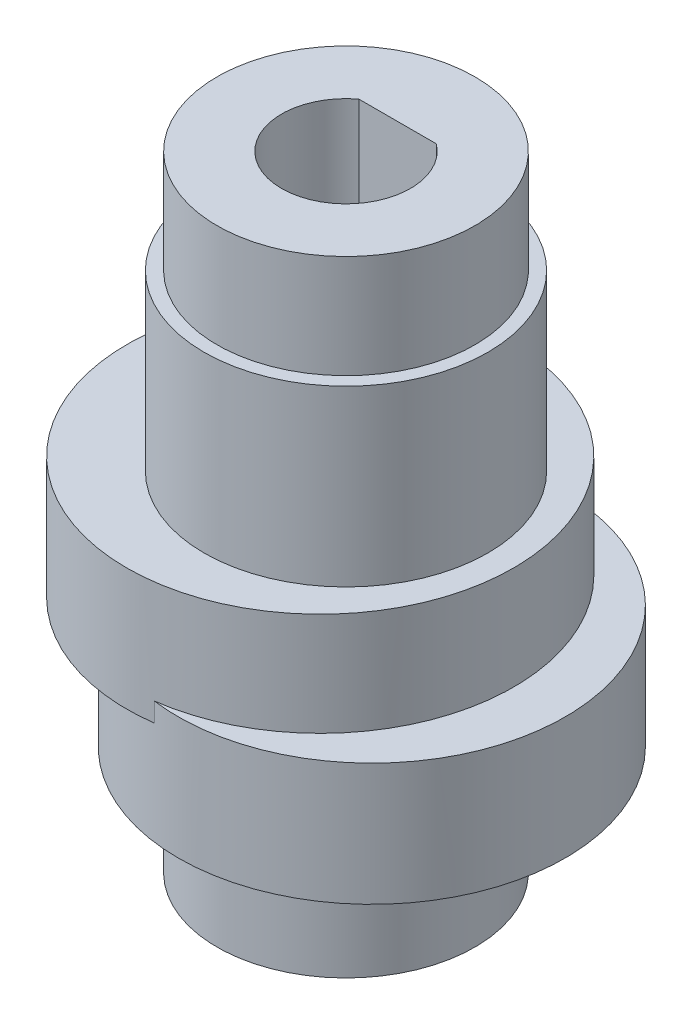
from build123d import *

# Parameters (mm, degrees)
SKETCH1_R           = 7.5
BOSS_EXTRUDE1_DEPTH = 4.74
BOSS_EXTRUDE2_DEPTH = 0.74
BOSS_EXTRUDE3_START = -4
SKETCH1_4_R         = 7.5
BOSS_EXTRUDE3_DEPTH = 4
BOSS_EXTRUDE4_START = 4.74
SKETCH2_R           = 5
BOSS_EXTRUDE4_DEPTH = 4.74
BOSS_EXTRUDE5_START = 0.74
SKETCH2_3_R         = 5.5
SKETCH2_3_R_2       = 5
BOSS_EXTRUDE5_DEPTH = 0.74
SKETCH2_5_R         = 5.5
SKETCH2_5_R_2       = 5
BOSS_EXTRUDE6_DEPTH = 15.48
SKETCH2_6_R         = 5
BOSS_EXTRUDE7_DEPTH = 19.48


with BuildPart() as part:
    # Sketch1 → Boss-Extrude1 (new body)
    with BuildSketch(Plane(origin=(0, 0, 0), x_dir=(1, 0, 0), z_dir=(0, 1, 0))):
        with Locations((-1, 0)):
            Circle(SKETCH1_R)
        with BuildLine():
            ThreePointArc((1.5, 2), (0, -2.5), (-1.5, 2))
            Line((-1.5, 2), (1.5, 2))
        make_face(mode=Mode.SUBTRACT)
    extrude(amount=BOSS_EXTRUDE1_DEPTH)

    # Sketch1<3> → Boss-Extrude2 (add)
    with BuildSketch(Plane(origin=(0, 0, 0), x_dir=(1, 0, 0), z_dir=(0, 1, 0))):
        with BuildLine():
            ThreePointArc((0, -7.433034374), (5.937104415, -5.645794895), (8.5, 0))
            ThreePointArc((8.5, 0), (5.937104415, 5.645794895), (0, 7.433034374))
            ThreePointArc((0, 7.433034374), (4.645794895, 4.937104415), (6.5, 0))
            ThreePointArc((6.5, 0), (4.645794895, -4.937104415), (0, -7.433034374))
        make_face()
    extrude(amount=BOSS_EXTRUDE2_DEPTH)

    # Sketch1<4> → Boss-Extrude3 (add)
    with BuildSketch(Plane(origin=(0, 0, 0), x_dir=(1, 0, 0), z_dir=(0, 1, 0)).offset(BOSS_EXTRUDE3_START)):
        with Locations((1, 0)):
            Circle(SKETCH1_4_R)
        with BuildLine():
            ThreePointArc((1.5, 2), (0, -2.5), (-1.5, 2))
            Line((-1.5, 2), (1.5, 2))
        make_face(mode=Mode.SUBTRACT)
    extrude(amount=BOSS_EXTRUDE3_DEPTH)

    # Sketch2 → Boss-Extrude4 (add)
    with BuildSketch(Plane.XZ.offset(4).offset(BOSS_EXTRUDE4_START)):
        Circle(SKETCH2_R)
        with BuildLine():
            Line((1.5, -2), (-1.5, -2))
            ThreePointArc((-1.5, -2), (0, 2.5), (1.5, -2))
        make_face(mode=Mode.SUBTRACT)
    extrude(amount=-BOSS_EXTRUDE4_DEPTH)

    # Sketch2<3> → Boss-Extrude5 (add)
    with BuildSketch(Plane.XZ.offset(4).offset(BOSS_EXTRUDE5_START)):
        Circle(SKETCH2_3_R)
        Circle(SKETCH2_3_R_2, mode=Mode.SUBTRACT)
    extrude(amount=-BOSS_EXTRUDE5_DEPTH)

    # Sketch2<5> → Boss-Extrude6 (add)
    with BuildSketch(Plane.XZ.offset(4)):
        Circle(SKETCH2_5_R)
        Circle(SKETCH2_5_R_2, mode=Mode.SUBTRACT)
    extrude(amount=-BOSS_EXTRUDE6_DEPTH)

    # Sketch2<6> → Boss-Extrude7 (add)
    with BuildSketch(Plane.XZ.offset(4)):
        Circle(SKETCH2_6_R)
        with BuildLine():
            Line((1.5, -2), (-1.5, -2))
            ThreePointArc((-1.5, -2), (0, 2.5), (1.5, -2))
        make_face(mode=Mode.SUBTRACT)
    extrude(amount=-BOSS_EXTRUDE7_DEPTH)


solid = part.part
